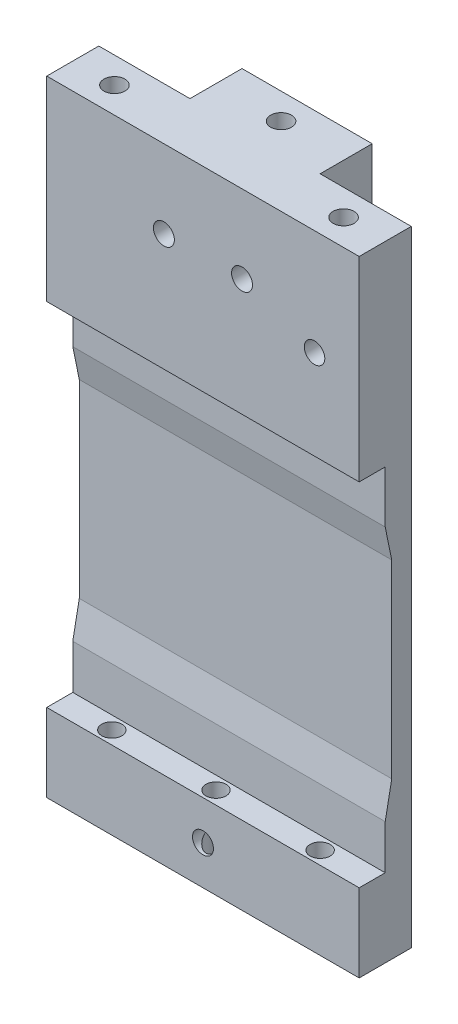
from build123d import *

# Parameters (mm, degrees)
BOSS_EXTRUDE1_DEPTH              = 76.2
CUT_EXTRUDE3_DEPTH               = 47.625
CUT_EXTRUDE4_DEPTH               = 110.433918417
F_10_0_1935_DIAMETER_HOLE1_D     = 4.9149
F_10_0_1935_DIAMETER_HOLE1_DEPTH = 19.05
F_10_0_1935_DIAMETER_HOLE1_TIP   = 1.476584928
F_1_4_20_TAPPED_HOLE1_D          = 5.1054
SKETCH19_R                       = 2.499999953
CUT_EXTRUDE5_DEPTH               = 87.135590889
F_1_4_20_TAPPED_HOLE2_D          = 5.1054
F_1_4_20_TAPPED_HOLE2_DEPTH      = 39.53002
F_1_4_20_TAPPED_HOLE2_TIP        = 1.533816902
F_1_4_20_TAPPED_HOLE3_D          = 5.1054
F_1_4_20_TAPPED_HOLE3_DEPTH      = 42.07002
F_1_4_20_TAPPED_HOLE3_TIP        = 1.533816902


with BuildPart() as part:
    # Sketch1 → Boss-Extrude1 (new, symmetric)
    with BuildSketch(Plane(origin=(0, 0, 0), x_dir=(1, 0, 0), z_dir=(0, 1, 0))):
        Polygon((-15.875, 6.35), (-15.875, 19.05), (15.875, 19.05), (15.875, 6.35), (38.1, 6.35), (38.1, -6.35), (-38.1, -6.35), (-38.1, 6.35), align=None)
    extrude(amount=BOSS_EXTRUDE1_DEPTH, both=True)

    # Sketch5 → Cut-Extrude3 (cut, symmetric)
    with BuildSketch(Plane(origin=(0, 0, 0), x_dir=(1, 0, 0), z_dir=(0, 1, 0))):
        with BuildLine():
            Line((-4.7625, 19.05), (-4.7625, 12.7))
            ThreePointArc((-4.7625, 12.7), (0, 7.9375), (4.7625, 12.7))
            Line((4.7625, 12.7), (4.7625, 19.05))
            Line((4.7625, 19.05), (-4.7625, 19.05))
        make_face()
    extrude(amount=CUT_EXTRUDE3_DEPTH, both=True, mode=Mode.SUBTRACT)

    # Sketch9 → Cut-Revolve1 (revolve, cut)
    with BuildSketch(Plane(origin=(0, 0, 0), x_dir=(0, 0, -1), z_dir=(1, 0, 0))):
        with BuildLine():
            Line((19.05, -52.3875), (12.7, -52.3875))
            ThreePointArc((12.7, -52.3875), (9.332403955, -50.992596045), (7.9375, -47.625))
            Line((7.9375, -47.625), (19.05, -47.625))
            Line((19.05, -47.625), (19.05, -52.3875))
        make_face()
    cut_revolve1 = revolve(axis=Axis((0, -47.625, -7.9375), (0, 0, -1)), mode=Mode.SUBTRACT)

    # Mirror1: Cut-Revolve1 across plane
    add(cut_revolve1.mirror(Plane.ZX), mode=Mode.SUBTRACT)

    # Sketch12 → Cut-Extrude4 (cut, through all)
    with BuildSketch(Plane(origin=(38.1, 0, 0), x_dir=(0, 0, -1), z_dir=(1, 0, 0))):
        Polygon((-6.35, -57.15), (0, -57.15), (0, -46.343697859), (1.5875, -38.1), (1.5875, 8.129025313), (0, 15.875), (0, 28.575), (-6.35, 28.575), align=None)
    extrude(amount=-CUT_EXTRUDE4_DEPTH, mode=Mode.SUBTRACT)

    # #10 (0.1935) Diameter Hole1
    with Locations(Plane(origin=(0, -76.2, 0), x_dir=(-1, 0, 0), z_dir=(0, -1, 0))):
        with Locations((25.4, -3.175), (-25.4, -3.175), (0, -3.175)):
            Hole(F_10_0_1935_DIAMETER_HOLE1_D / 2, depth=F_10_0_1935_DIAMETER_HOLE1_DEPTH)
            with Locations((0, 0, -(F_10_0_1935_DIAMETER_HOLE1_DEPTH + F_10_0_1935_DIAMETER_HOLE1_TIP / 2))):  # 118° drill point
                Cone(0, F_10_0_1935_DIAMETER_HOLE1_D / 2, F_10_0_1935_DIAMETER_HOLE1_TIP, mode=Mode.SUBTRACT)

    # 1/4-20 Tapped Hole1 (through all)
    with Locations(Plane(origin=(0, 76.2, 0), x_dir=(1, 0, 0), z_dir=(0, 1, 0))):
        with Locations((0, 12.7)):
            Hole(F_1_4_20_TAPPED_HOLE1_D / 2)

    # Sketch19 → Cut-Extrude5 (cut, through all)
    with BuildSketch(Plane(origin=(0, 0, -6.35), x_dir=(-1, 0, 0), z_dir=(0, 0, -1))):
        with Locations((-27.209019229, 50.43691079)):
            Circle(SKETCH19_R)
    extrude(amount=-CUT_EXTRUDE5_DEPTH, mode=Mode.SUBTRACT)

    # 1/4-20 Tapped Hole2
    with Locations(Plane(origin=(0, 76.2, 0), x_dir=(1, 0, 0), z_dir=(0, 1, 0))):
        with Locations((27.94, 0), (-27.94, 0)):
            Hole(F_1_4_20_TAPPED_HOLE2_D / 2, depth=F_1_4_20_TAPPED_HOLE2_DEPTH)
            with Locations((0, 0, -(F_1_4_20_TAPPED_HOLE2_DEPTH + F_1_4_20_TAPPED_HOLE2_TIP / 2))):  # 118° drill point
                Cone(0, F_1_4_20_TAPPED_HOLE2_D / 2, F_1_4_20_TAPPED_HOLE2_TIP, mode=Mode.SUBTRACT)

    # 1/4-20 Tapped Hole3
    with Locations(Plane(origin=(0, 0, -19.05), x_dir=(-1, 0, 0), z_dir=(0, 0, -1))):
        with Locations((0, -66.675), (9.525, 57.15), (-9.525, 57.15)):
            Hole(F_1_4_20_TAPPED_HOLE3_D / 2, depth=F_1_4_20_TAPPED_HOLE3_DEPTH)
            with Locations((0, 0, -(F_1_4_20_TAPPED_HOLE3_DEPTH + F_1_4_20_TAPPED_HOLE3_TIP / 2))):  # 118° drill point
                Cone(0, F_1_4_20_TAPPED_HOLE3_D / 2, F_1_4_20_TAPPED_HOLE3_TIP, mode=Mode.SUBTRACT)


solid = part.part
